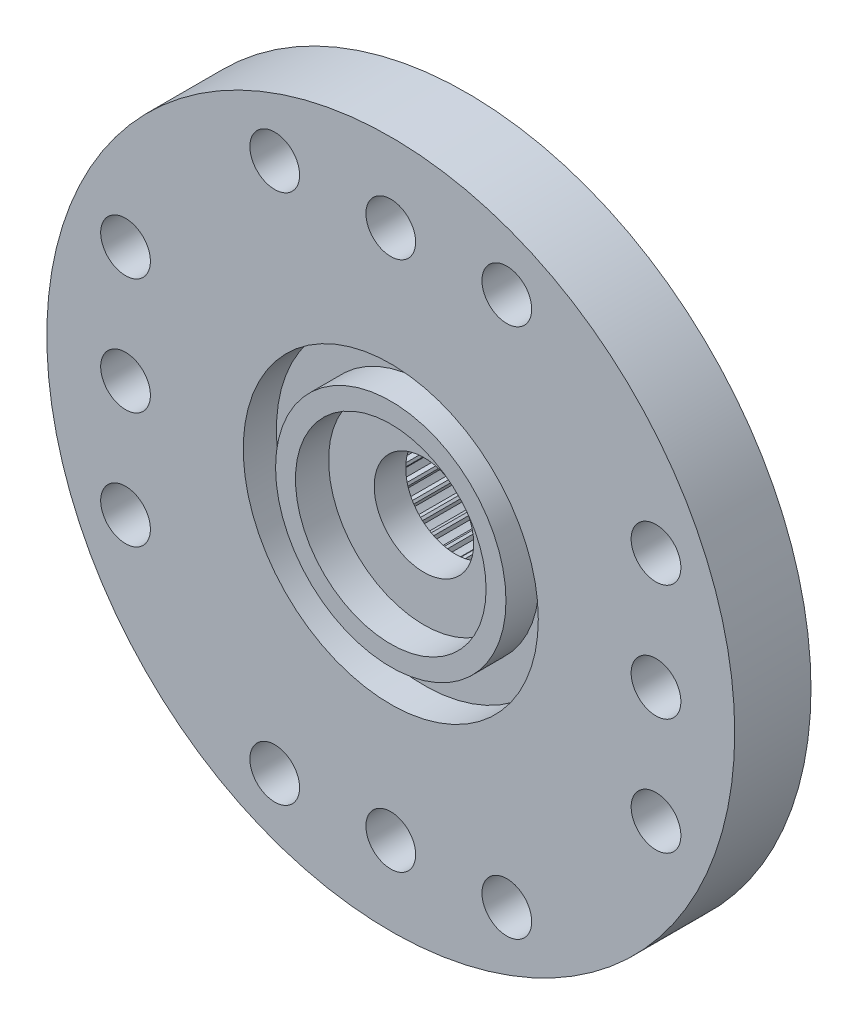
from build123d import *

# Parameters (mm, degrees)
ESQUISSE1_R             = 10.375
BOSS_EXTRU_1_DEPTH      = 2.3
ESQUISSE2_R             = 4.45
ENL_V_MAT_EXTRU_1_DEPTH = 1
ESQUISSE3_R             = 3.475
ESQUISSE3_R_2           = 2.875
BOSS_EXTRU_2_DEPTH      = 1
ESQUISSE4_R             = 4.4
BOSS_EXTRU_3_DEPTH      = 3
ESQUISSE5_R             = 1.5
ENL_V_MAT_EXTRU_2_DEPTH = 16.289579785
ENL_V_START             = -3.35
ESQUISSE6_R             = 1.5
ENL_V_MAT_EXTRU_3_DEPTH = 3.35
ESQUISSE7_R             = 0.75
ENL_V_MAT_EXTRU_4_DEPTH = 3.35


with BuildPart() as part:
    # Esquisse1 → Boss.-Extru.1 (new body)
    with BuildSketch(Plane.XY):
        Circle(ESQUISSE1_R)
    extrude(amount=BOSS_EXTRU_1_DEPTH)

    # Esquisse2 → Enlèv. mat.-Extru.1 (cut)
    with BuildSketch(Plane.XY.offset(2.3)):
        Circle(ESQUISSE2_R)
    extrude(amount=-ENL_V_MAT_EXTRU_1_DEPTH, mode=Mode.SUBTRACT)

    # Esquisse3 → Boss.-Extru.2 (add)
    with BuildSketch(Plane.XY.offset(1.3)):
        Circle(ESQUISSE3_R)
        Circle(ESQUISSE3_R_2, mode=Mode.SUBTRACT)
    extrude(amount=BOSS_EXTRU_2_DEPTH)

    # Esquisse4 → Boss.-Extru.3 (add)
    with BuildSketch(Plane(origin=(0, 0, 0), x_dir=(-1, 0, 0), z_dir=(0, 0, -1))):
        Circle(ESQUISSE4_R)
    extrude(amount=BOSS_EXTRU_3_DEPTH)

    # Esquisse5 → Enlèv. mat.-Extru.2 (cut, through all)
    with BuildSketch(Plane.XY.offset(1.3)):
        Circle(ESQUISSE5_R)
    extrude(amount=-ENL_V_MAT_EXTRU_2_DEPTH, mode=Mode.SUBTRACT)

    # Esquisse6 → Enlèv. mat.-Extru.3 (cut)
    with BuildSketch(Plane(origin=(0, 0, -3), x_dir=(-1, 0, 0), z_dir=(0, 0, -1)).offset(ENL_V_START)):
        with BuildLine():
            Line((-0.040605305, 2.865160176), (-0.114276657, 2.997822684))
            ThreePointArc((-0.114276657, 2.997822684), (-0.209269421, 2.992692151), (-0.304051754, 2.984552317))
            Line((-0.304051754, 2.984552317), (-0.35854309, 2.8429278))
            Line((-0.35854309, 2.8429278), (-0.438963363, 2.831625467))
            Line((-0.438963363, 2.831625467), (-0.530380804, 2.952743843))
            ThreePointArc((-0.530380804, 2.952743843), (-0.623735072, 2.934442802), (-0.716462144, 2.913191033))
            Line((-0.716462144, 2.913191033), (-0.750712851, 2.765361068))
            Line((-0.750712851, 2.765361068), (-0.828777499, 2.742976391))
            Line((-0.828777499, 2.742976391), (-0.936161691, 2.850193202))
            ThreePointArc((-0.936161691, 2.850193202), (-1.02606043, 2.819077862), (-1.114927414, 2.7851278))
            Line((-1.114927414, 2.7851278), (-1.12827084, 2.633969729))
            Line((-1.12827084, 2.633969729), (-1.202460424, 2.600938398))
            Line((-1.202460424, 2.600938398), (-1.323721256, 2.692166792))
            ThreePointArc((-1.323721256, 2.692166792), (-1.408414688, 2.648842779), (-1.491691889, 2.602855222))
            Line((-1.491691889, 2.602855222), (-1.483868321, 2.451311165))
            Line((-1.483868321, 2.451311165), (-1.552738824, 2.408276099))
            Line((-1.552738824, 2.408276099), (-1.685516093, 2.481740418))
            ThreePointArc((-1.685516093, 2.481740418), (-1.763355757, 2.427050983), (-1.839422279, 2.369921028))
            Line((-1.839422279, 2.369921028), (-1.810583992, 2.220940618))
            Line((-1.810583992, 2.220940618), (-1.872794929, 2.168739444))
            Line((-1.872794929, 2.168739444), (-2.014504276, 2.223009789))
            ThreePointArc((-2.014504276, 2.223009789), (-2.083975111, 2.158019401), (-2.151350406, 2.090859017))
            Line((-2.151350406, 2.090859017), (-2.102058706, 1.947341988))
            Line((-2.102058706, 1.947341988), (-2.156399211, 1.886990743))
            Line((-2.156399211, 1.886990743), (-2.304282424, 1.921010804))
            ThreePointArc((-2.304282424, 1.921010804), (-2.364032261, 1.846984426), (-2.421404945, 1.771100813))
            Line((-2.421404945, 1.771100813), (-2.352619239, 1.635840561))
            Line((-2.352619239, 1.635840561), (-2.398031635, 1.568513914))
            Line((-2.398031635, 1.568513914), (-2.549210337, 1.581621528))
            ThreePointArc((-2.549210337, 1.581621528), (-2.598076211, 1.5), (-2.644329591, 1.416870147))
            Line((-2.644329591, 1.416870147), (-2.557388713, 1.292499358))
            Line((-2.557388713, 1.292499358), (-2.592989102, 1.219507746))
            Line((-2.592989102, 1.219507746), (-2.74452077, 1.211447789))
            ThreePointArc((-2.74452077, 1.211447789), (-2.781551564, 1.12381978), (-2.815785369, 1.035061715))
            Line((-2.815785369, 1.035061715), (-2.712381526, 0.924001126))
            Line((-2.712381526, 0.924001126), (-2.737476984, 0.846765246))
            Line((-2.737476984, 0.846765246), (-2.886412228, 0.817694596))
            ThreePointArc((-2.886412228, 0.817694596), (-2.910887179, 0.725765687), (-2.932435088, 0.633106984))
            Line((-2.932435088, 0.633106984), (-2.814580917, 0.537518262))
            Line((-2.814580917, 0.537518262), (-2.828682992, 0.457541424))
            Line((-2.828682992, 0.457541424), (-2.972122955, 0.408025908))
            ThreePointArc((-2.972122955, 0.408025908), (-2.983565686, 0.31358539), (-2.992008294, 0.218829546))
            Line((-2.992008294, 0.218829546), (-2.861997693, 0.140573217))
            Line((-2.861997693, 0.140573217), (-2.864831902, 0.059412079))
            Line((-2.864831902, 0.059412079), (-2.999984689, -0.00958454))
            ThreePointArc((-2.999984689, -0.00958454), (-2.998172481, -0.10469849), (-2.993345461, -0.19970716))
            Line((-2.993345461, -0.19970716), (-2.853708938, -0.259107925))
            Line((-2.853708938, -0.259107925), (-2.845220118, -0.339873655))
            Line((-2.845220118, -0.339873655), (-2.969455134, -0.427008436))
            ThreePointArc((-2.969455134, -0.427008436), (-2.954423259, -0.520944533), (-2.936420564, -0.614356794))
            Line((-2.936420564, -0.614356794), (-2.789875986, -0.653745827))
            Line((-2.789875986, -0.653745827), (-2.770229361, -0.732544135))
            Line((-2.770229361, -0.732544135), (-2.881128513, -0.836121099))
            ThreePointArc((-2.881128513, -0.836121099), (-2.853169549, -0.927050983), (-2.822341581, -1.017048672))
            Line((-2.822341581, -1.017048672), (-2.67174127, -1.03565931))
            Line((-2.67174127, -1.03565931), (-2.641319241, -1.110956476))
            Line((-2.641319241, -1.110956476), (-2.736724002, -1.228959615))
            ThreePointArc((-2.736724002, -1.228959615), (-2.696382139, -1.31511344), (-2.653328929, -1.399944854))
            Line((-2.653328929, -1.399944854), (-2.50160415, -1.397414862))
            Line((-2.50160415, -1.397414862), (-2.460998845, -1.467745313))
            Line((-2.460998845, -1.467745313), (-2.539052272, -1.59787783))
            ThreePointArc((-2.539052272, -1.59787783), (-2.487112718, -1.67757871), (-2.432672248, -1.755592702))
            Line((-2.432672248, -1.755592702), (-2.282776151, -1.731971324))
            Line((-2.282776151, -1.731971324), (-2.232777907, -1.795966158))
            Line((-2.232777907, -1.795966158), (-2.291960777, -1.935695171))
            ThreePointArc((-2.291960777, -1.935695171), (-2.229434476, -2.007391819), (-2.164666369, -2.077069935))
            Line((-2.164666369, -2.077069935), (-2.019516511, -2.032816934))
            Line((-2.019516511, -2.032816934), (-1.961098487, -2.089230564))
            Line((-1.961098487, -2.089230564), (-2.000258873, -2.235836408))
            ThreePointArc((-2.000258873, -2.235836408), (-1.928362829, -2.298133329), (-1.854527721, -2.358119364))
            Line((-1.854527721, -2.358119364), (-1.716949278, -2.294096074))
            Line((-1.716949278, -2.294096074), (-1.651248515, -2.341830473))
            Line((-1.651248515, -2.341830473), (-1.669624205, -2.492459631))
            ThreePointArc((-1.669624205, -2.492459631), (-1.589757793, -2.544144288), (-1.5082928, -2.593270682))
            Line((-1.5082928, -2.593270682), (-1.380963581, -2.510723244))
            Line((-1.380963581, -2.510723244), (-1.309258869, -2.548849316))
            Line((-1.309258869, -2.548849316), (-1.306492201, -2.700569964))
            ThreePointArc((-1.306492201, -2.700569964), (-1.220209929, -2.740636373), (-1.132700676, -2.777946936))
            Line((-1.132700676, -2.777946936), (-1.018098999, -2.678482042))
            Line((-1.018098999, -2.678482042), (-0.941785989, -2.706257707))
            Line((-0.941785989, -2.706257707), (-0.917930812, -2.856116773))
            ThreePointArc((-0.917930812, -2.856116773), (-0.826912067, -2.883785088), (-0.735061821, -2.908553613))
            Line((-0.735061821, -2.908553613), (-0.635418278, -2.794107234))
            Line((-0.635418278, -2.794107234), (-0.555982315, -2.810991869))
            Line((-0.555982315, -2.810991869), (-0.511502945, -2.956072519))
            ThreePointArc((-0.511502945, -2.956072519), (-0.417519303, -2.970804206), (-0.323115824, -2.982548602))
            Line((-0.323115824, -2.982548602), (-0.240369863, -2.855348306))
            Line((-0.240369863, -2.855348306), (-0.159357078, -2.861013272))
            Line((-0.159357078, -2.861013272), (-0.095119254, -2.998491675))
            ThreePointArc((-0.095119254, -2.998491675), (0, -3), (0.095119254, -2.998491675))
            Line((0.095119254, -2.998491675), (0.159357078, -2.861013272))
            Line((0.159357078, -2.861013272), (0.240369863, -2.855348306))
            Line((0.240369863, -2.855348306), (0.323115824, -2.982548602))
            ThreePointArc((0.323115824, -2.982548602), (0.417519303, -2.970804206), (0.511502945, -2.956072519))
            Line((0.511502945, -2.956072519), (0.555982315, -2.810991869))
            Line((0.555982315, -2.810991869), (0.635418278, -2.794107234))
            Line((0.635418278, -2.794107234), (0.735061821, -2.908553613))
            ThreePointArc((0.735061821, -2.908553613), (0.826912067, -2.883785088), (0.917930812, -2.856116773))
            Line((0.917930812, -2.856116773), (0.941785989, -2.706257707))
            Line((0.941785989, -2.706257707), (1.018098999, -2.678482042))
            Line((1.018098999, -2.678482042), (1.132700676, -2.777946936))
            ThreePointArc((1.132700676, -2.777946936), (1.220209929, -2.740636373), (1.306492201, -2.700569964))
            Line((1.306492201, -2.700569964), (1.309258869, -2.548849316))
            Line((1.309258869, -2.548849316), (1.380963581, -2.510723244))
            Line((1.380963581, -2.510723244), (1.5082928, -2.593270682))
            ThreePointArc((1.5082928, -2.593270682), (1.589757793, -2.544144288), (1.669624205, -2.492459631))
            Line((1.669624205, -2.492459631), (1.651248515, -2.341830473))
            Line((1.651248515, -2.341830473), (1.716949278, -2.294096074))
            Line((1.716949278, -2.294096074), (1.854527721, -2.358119364))
            ThreePointArc((1.854527721, -2.358119364), (1.928362829, -2.298133329), (2.000258873, -2.235836408))
            Line((2.000258873, -2.235836408), (1.961098487, -2.089230564))
            Line((1.961098487, -2.089230564), (2.019516511, -2.032816934))
            Line((2.019516511, -2.032816934), (2.164666369, -2.077069935))
            ThreePointArc((2.164666369, -2.077069935), (2.229434476, -2.007391819), (2.291960777, -1.935695171))
            Line((2.291960777, -1.935695171), (2.232777907, -1.795966158))
            Line((2.232777907, -1.795966158), (2.282776151, -1.731971324))
            Line((2.282776151, -1.731971324), (2.432672248, -1.755592702))
            ThreePointArc((2.432672248, -1.755592702), (2.487112718, -1.67757871), (2.539052272, -1.59787783))
            Line((2.539052272, -1.59787783), (2.460998845, -1.467745313))
            Line((2.460998845, -1.467745313), (2.50160415, -1.397414862))
            Line((2.50160415, -1.397414862), (2.653328929, -1.399944854))
            ThreePointArc((2.653328929, -1.399944854), (2.696382139, -1.31511344), (2.736724002, -1.228959615))
            Line((2.736724002, -1.228959615), (2.641319241, -1.110956476))
            Line((2.641319241, -1.110956476), (2.67174127, -1.03565931))
            Line((2.67174127, -1.03565931), (2.822341581, -1.017048672))
            ThreePointArc((2.822341581, -1.017048672), (2.853169549, -0.927050983), (2.881128513, -0.836121099))
            Line((2.881128513, -0.836121099), (2.770229361, -0.732544135))
            Line((2.770229361, -0.732544135), (2.789875986, -0.653745827))
            Line((2.789875986, -0.653745827), (2.936420564, -0.614356794))
            ThreePointArc((2.936420564, -0.614356794), (2.954423259, -0.520944533), (2.969455134, -0.427008436))
            Line((2.969455134, -0.427008436), (2.845220118, -0.339873655))
            Line((2.845220118, -0.339873655), (2.853708938, -0.259107925))
            Line((2.853708938, -0.259107925), (2.993345461, -0.19970716))
            ThreePointArc((2.993345461, -0.19970716), (2.998172481, -0.10469849), (2.999984689, -0.00958454))
            Line((2.999984689, -0.00958454), (2.864831902, 0.059412079))
            Line((2.864831902, 0.059412079), (2.861997693, 0.140573217))
            Line((2.861997693, 0.140573217), (2.992008294, 0.218829546))
            ThreePointArc((2.992008294, 0.218829546), (2.983565686, 0.31358539), (2.972122955, 0.408025908))
            Line((2.972122955, 0.408025908), (2.828682992, 0.457541424))
            Line((2.828682992, 0.457541424), (2.814580917, 0.537518262))
            Line((2.814580917, 0.537518262), (2.932435088, 0.633106984))
            ThreePointArc((2.932435088, 0.633106984), (2.910887179, 0.725765687), (2.886412228, 0.817694596))
            Line((2.886412228, 0.817694596), (2.737476984, 0.846765246))
            Line((2.737476984, 0.846765246), (2.712381526, 0.924001126))
            Line((2.712381526, 0.924001126), (2.815785369, 1.035061715))
            ThreePointArc((2.815785369, 1.035061715), (2.781551564, 1.12381978), (2.74452077, 1.211447789))
            Line((2.74452077, 1.211447789), (2.592989102, 1.219507746))
            Line((2.592989102, 1.219507746), (2.557388713, 1.292499358))
            Line((2.557388713, 1.292499358), (2.644329591, 1.416870147))
            ThreePointArc((2.644329591, 1.416870147), (2.598076211, 1.5), (2.549210337, 1.581621528))
            Line((2.549210337, 1.581621528), (2.398031635, 1.568513914))
            Line((2.398031635, 1.568513914), (2.352619239, 1.635840561))
            Line((2.352619239, 1.635840561), (2.421404945, 1.771100813))
            ThreePointArc((2.421404945, 1.771100813), (2.364032261, 1.846984426), (2.304282424, 1.921010804))
            Line((2.304282424, 1.921010804), (2.156399211, 1.886990743))
            Line((2.156399211, 1.886990743), (2.102058706, 1.947341988))
            Line((2.102058706, 1.947341988), (2.151350406, 2.090859017))
            ThreePointArc((2.151350406, 2.090859017), (2.083975111, 2.158019401), (2.014504276, 2.223009789))
            Line((2.014504276, 2.223009789), (1.872794929, 2.168739444))
            Line((1.872794929, 2.168739444), (1.810583992, 2.220940618))
            Line((1.810583992, 2.220940618), (1.839422279, 2.369921028))
            ThreePointArc((1.839422279, 2.369921028), (1.763355757, 2.427050983), (1.685516093, 2.481740418))
            Line((1.685516093, 2.481740418), (1.552738824, 2.408276099))
            Line((1.552738824, 2.408276099), (1.483868321, 2.451311165))
            Line((1.483868321, 2.451311165), (1.491691889, 2.602855222))
            ThreePointArc((1.491691889, 2.602855222), (1.408414688, 2.648842779), (1.323721256, 2.692166792))
            Line((1.323721256, 2.692166792), (1.202460424, 2.600938398))
            Line((1.202460424, 2.600938398), (1.12827084, 2.633969729))
            Line((1.12827084, 2.633969729), (1.114927414, 2.7851278))
            ThreePointArc((1.114927414, 2.7851278), (1.02606043, 2.819077862), (0.936161691, 2.850193202))
            Line((0.936161691, 2.850193202), (0.828777499, 2.742976391))
            Line((0.828777499, 2.742976391), (0.750712851, 2.765361068))
            Line((0.750712851, 2.765361068), (0.716462144, 2.913191033))
            ThreePointArc((0.716462144, 2.913191033), (0.623735072, 2.934442802), (0.530380804, 2.952743843))
            Line((0.530380804, 2.952743843), (0.438963363, 2.831625467))
            Line((0.438963363, 2.831625467), (0.35854309, 2.8429278))
            Line((0.35854309, 2.8429278), (0.304051754, 2.984552317))
            ThreePointArc((0.304051754, 2.984552317), (0.209269421, 2.992692151), (0.114276657, 2.997822684))
            Line((0.114276657, 2.997822684), (0.040605305, 2.865160176))
            Line((0.040605305, 2.865160176), (-0.040605305, 2.865160176))
        make_face()
        with Locations(Location((0, 0, 0), (0, 0, 180))):
            Circle(ESQUISSE6_R, mode=Mode.SUBTRACT)
    extrude(amount=ENL_V_MAT_EXTRU_3_DEPTH, mode=Mode.SUBTRACT)

    # Esquisse7 → Enlèv. mat.-Extru.4 (cut)
    with BuildSketch(Plane.XY.offset(2.3)):
        with Locations((-8, 0)):
            Circle(ESQUISSE7_R)
        with Locations((-8, 3.5)):
            Circle(ESQUISSE7_R)
        with Locations((-8, -3.5)):
            Circle(ESQUISSE7_R)
        with Locations((0, 8)):
            Circle(ESQUISSE7_R)
        with Locations((3.5, 8)):
            Circle(ESQUISSE7_R)
        with Locations((-3.5, 8)):
            Circle(ESQUISSE7_R)
        with Locations((8, 0)):
            Circle(ESQUISSE7_R)
        with Locations((8, -3.5)):
            Circle(ESQUISSE7_R)
        with Locations((8, 3.5)):
            Circle(ESQUISSE7_R)
        with Locations((0, -8)):
            Circle(ESQUISSE7_R)
        with Locations((-3.5, -8)):
            Circle(ESQUISSE7_R)
        with Locations((3.5, -8)):
            Circle(ESQUISSE7_R)
    extrude(amount=-ENL_V_MAT_EXTRU_4_DEPTH, mode=Mode.SUBTRACT)


solid = part.part
